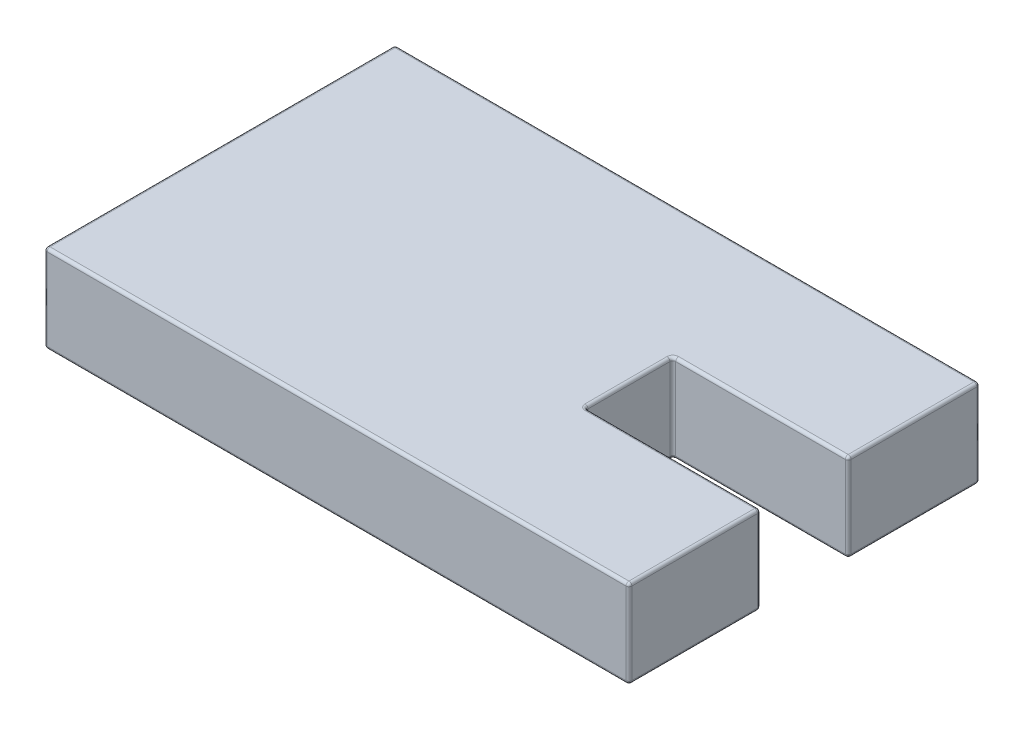
from build123d import *

# Parameters (mm, degrees)
SKETCH1_W           = 200
SKETCH1_H           = 30
BOSS_EXTRUDE1_DEPTH = 60
SKETCH2_W           = 60
SKETCH2_H           = 30
CUT_EXTRUDE2_DEPTH  = 121.415945788
FILLET1_R           = 1


with BuildPart() as part:
    # Sketch1 → Boss-Extrude1 (new, symmetric)
    with BuildSketch(Plane.XY):
        Rectangle(SKETCH1_W, SKETCH1_H)
    extrude(amount=BOSS_EXTRUDE1_DEPTH, both=True)

    # Sketch2 → Cut-Extrude2 (cut, through all)
    with BuildSketch(Plane(origin=(0, 15, 0), x_dir=(1, 0, 0), z_dir=(0, 1, 0))):
        with Locations((70, 0)):
            Rectangle(SKETCH2_W, SKETCH2_H)
    extrude(amount=-CUT_EXTRUDE2_DEPTH, mode=Mode.SUBTRACT)

    # Fillet1
    fillet1_edges = [part.edges().sort_by_distance(p)[0] for p in [
        (70, -15, -15),
        (100, -15, -37.5),
        (100, 0, -15),
        (70, 15, -15),
        (40, 0, -15),
        (40, -15, 0),
        (0, -15, -60),
        (100, 0, -60),
        (100, 15, -37.5),
        (40, 15, 0),
        (40, 0, 15),
        (70, -15, 15),
        (-100, -15, 0),
        (-100, 0, -60),
        (0, 15, -60),
        (100, 0, 15),
        (70, 15, 15),
        (100, -15, 37.5),
        (0, -15, 60),
        (-100, 0, 60),
        (-100, 15, 0),
        (100, 15, 37.5),
        (100, 0, 60),
        (0, 15, 60),
    ]]
    fillet(fillet1_edges, radius=FILLET1_R)


solid = part.part
